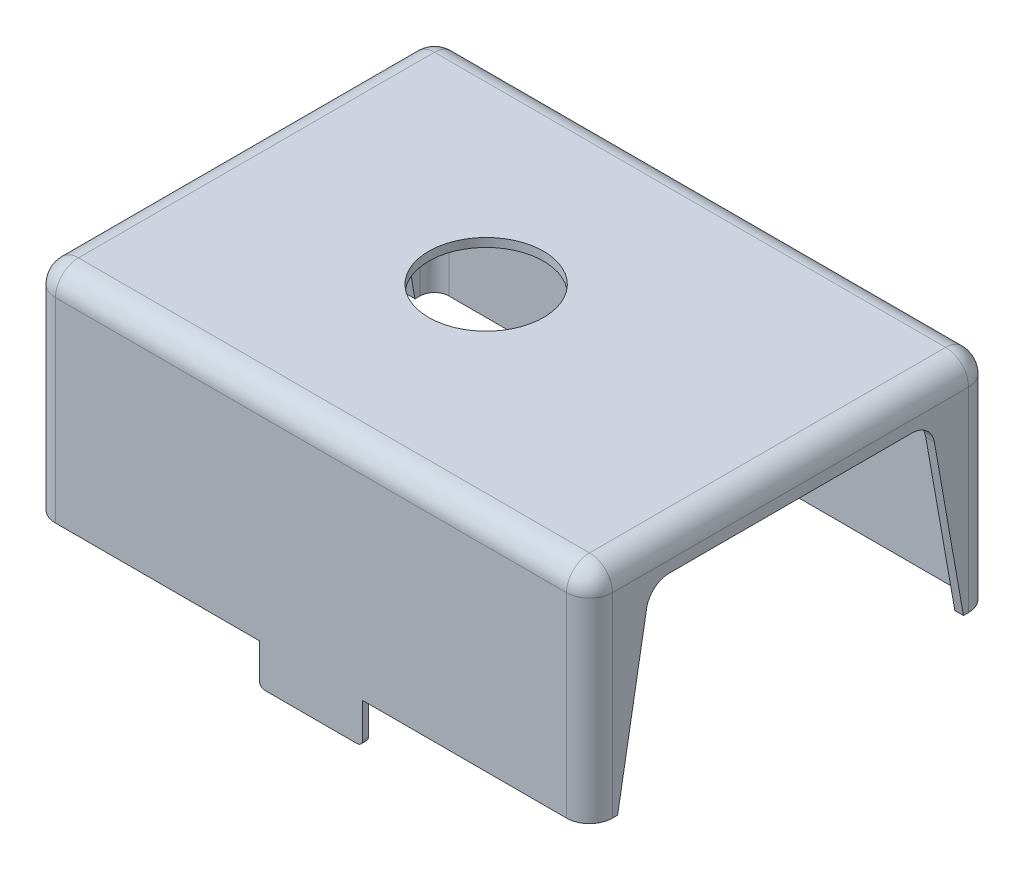
from build123d import *

# Parameters (mm, degrees)
RESSALTO_EXTRUS_O1_DEPTH           = 38
FILETE1_R                          = 4
CASCA1_T                           = -1.5
CORTE_EXTRUS_O1_DEPTH              = 50
ESBO_O3_R                          = 2
ESBO_O3_R_2                        = 1
RESSALTO_EXTRUS_O2_DEPTH           = 5
RESSALTO_EXTRUS_O2_DRAFT           = 2
RESSALTO_EXTRUS_O2_PROFILE_2_DEPTH = 5
RESSALTO_EXTRUS_O2_PROFILE_2_DRAFT = 2
RESSALTO_EXTRUS_O2_PROFILE_3_DEPTH = 5
RESSALTO_EXTRUS_O2_PROFILE_3_DRAFT = 2
RESSALTO_EXTRUS_O2_PROFILE_4_DEPTH = 5
RESSALTO_EXTRUS_O2_PROFILE_4_DRAFT = 2
RESSALTO_EXTRUS_O3_DEPTH           = 1
RESSALTO_EXTRUS_O4_DEPTH           = 5.5
ESBO_O6_R                          = 10
CORTE_EXTRUS_O2_DEPTH              = 75.848179671


with BuildPart() as part:
    # Esboço1 → Ressalto-extrusão1 (new body)
    with BuildSketch(Plane(origin=(0, 0, 0), x_dir=(1, 0, 0), z_dir=(0, 1, 0))):
        with BuildLine():
            Line((-44.5, 35), (44.5, 35))
            ThreePointArc((44.5, 35), (47.328427125, 33.828427125), (48.5, 31))
            Line((48.5, 31), (48.5, -31))
            ThreePointArc((48.5, -31), (47.328427125, -33.828427125), (44.5, -35))
            Line((44.5, -35), (-44.5, -35))
            ThreePointArc((-44.5, -35), (-47.328427125, -33.828427125), (-48.5, -31))
            Line((-48.5, -31), (-48.5, 31))
            ThreePointArc((-48.5, 31), (-47.328427125, 33.828427125), (-44.5, 35))
        make_face()
    extrude(amount=-RESSALTO_EXTRUS_O1_DEPTH)

    # Filete1
    filete1_edges = [part.edges().sort_by_distance(p)[0] for p in [
        (48.5, 0, 0),
        (47.328427125, 0, 33.828427125),
        (0, 0, 35),
        (-47.328427125, 0, 33.828427125),
        (-48.5, 0, 0),
        (-47.328427125, 0, -33.828427125),
        (0, 0, -35),
        (47.328427125, 0, -33.828427125),
    ]]
    fillet(filete1_edges, radius=FILETE1_R)

    # Casca1
    casca1_openings = [part.faces().sort_by_distance(p)[0] for p in [
        (0, -38, 0),
    ]]
    offset(amount=CASCA1_T, openings=casca1_openings, kind=Kind.INTERSECTION)

    # Esboço2 → Corte-extrusão1 (cut, symmetric)
    with BuildSketch(Plane(origin=(0, 0, 0), x_dir=(0, 0, -1), z_dir=(1, 0, 0))):
        with BuildLine():
            Line((-21.110742301, -6), (21.110742301, -6))
            ThreePointArc((21.110742301, -6), (23.68189274, -6.935822228), (25.049973313, -9.305407289))
            Line((25.049973313, -9.305407289), (31, -43.049685465))
            Line((31, -43.049685465), (-31, -43.049685465))
            Line((-31, -43.049685465), (-25.049973313, -9.305407289))
            ThreePointArc((-25.049973313, -9.305407289), (-23.68189274, -6.935822228), (-21.110742301, -6))
        make_face()
    extrude(amount=CORTE_EXTRUS_O1_DEPTH, both=True, mode=Mode.SUBTRACT)


with BuildPart() as ressalto_extrus_o2_tool:
    # Esboço3 → Ressalto-extrusão2 (with draft: the straight prism first)
    with BuildSketch(Plane.XZ.offset(1.5)):
        with Locations((-28, 15)):
            Circle(ESBO_O3_R)
        with Locations((-28, 15)):
            Circle(ESBO_O3_R_2, mode=Mode.SUBTRACT)
    extrude(amount=RESSALTO_EXTRUS_O2_DEPTH)
    # Ressalto-extrusão2: the draft: its side faces are tilted about the plane it starts from
    ressalto_extrus_o2_sides = [ressalto_extrus_o2_tool.faces().sort_by_distance(p)[0] for p in [
        (-30, -4, 15),
        (-29, -4, 15),
    ]]
    draft(ressalto_extrus_o2_sides, Plane.XZ.offset(1.5), RESSALTO_EXTRUS_O2_DRAFT)


with BuildPart() as part_1:
    add(part.part)

    # Ressalto-extrusão2: add ressalto_extrus_o2_tool
    add(ressalto_extrus_o2_tool.part)


with BuildPart() as ressalto_extrus_o2_profile_2_tool:
    # Esboço3 → Ressalto-extrusão2 profile 2 (with draft: the straight prism first)
    with BuildSketch(Plane.XZ.offset(1.5)):
        with Locations((28, 15)):
            Circle(ESBO_O3_R)
        with Locations((28, 15)):
            Circle(ESBO_O3_R_2, mode=Mode.SUBTRACT)
    extrude(amount=RESSALTO_EXTRUS_O2_PROFILE_2_DEPTH)
    # Ressalto-extrusão2 profile 2: the draft: its side faces are tilted about the plane it starts from
    ressalto_extrus_o2_profile_2_sides = [ressalto_extrus_o2_profile_2_tool.faces().sort_by_distance(p)[0] for p in [
        (26, -4, 15),
        (27, -4, 15),
    ]]
    draft(ressalto_extrus_o2_profile_2_sides, Plane.XZ.offset(1.5), RESSALTO_EXTRUS_O2_PROFILE_2_DRAFT)


with BuildPart() as part_2:
    add(part_1.part)

    # Ressalto-extrusão2 profile 2: add ressalto_extrus_o2_profile_2_tool
    add(ressalto_extrus_o2_profile_2_tool.part)


with BuildPart() as ressalto_extrus_o2_profile_3_tool:
    # Esboço3 → Ressalto-extrusão2 profile 3 (with draft: the straight prism first)
    with BuildSketch(Plane.XZ.offset(1.5)):
        with Locations((28, -15)):
            Circle(ESBO_O3_R)
        with Locations((28, -15)):
            Circle(ESBO_O3_R_2, mode=Mode.SUBTRACT)
    extrude(amount=RESSALTO_EXTRUS_O2_PROFILE_3_DEPTH)
    # Ressalto-extrusão2 profile 3: the draft: its side faces are tilted about the plane it starts from
    ressalto_extrus_o2_profile_3_sides = [ressalto_extrus_o2_profile_3_tool.faces().sort_by_distance(p)[0] for p in [
        (26, -4, -15),
        (27, -4, -15),
    ]]
    draft(ressalto_extrus_o2_profile_3_sides, Plane.XZ.offset(1.5), RESSALTO_EXTRUS_O2_PROFILE_3_DRAFT)


with BuildPart() as part_3:
    add(part_2.part)

    # Ressalto-extrusão2 profile 3: add ressalto_extrus_o2_profile_3_tool
    add(ressalto_extrus_o2_profile_3_tool.part)


with BuildPart() as ressalto_extrus_o2_profile_4_tool:
    # Esboço3 → Ressalto-extrusão2 profile 4 (with draft: the straight prism first)
    with BuildSketch(Plane.XZ.offset(1.5)):
        with Locations((-28, -15)):
            Circle(ESBO_O3_R)
        with Locations((-28, -15)):
            Circle(ESBO_O3_R_2, mode=Mode.SUBTRACT)
    extrude(amount=RESSALTO_EXTRUS_O2_PROFILE_4_DEPTH)
    # Ressalto-extrusão2 profile 4: the draft: its side faces are tilted about the plane it starts from
    ressalto_extrus_o2_profile_4_sides = [ressalto_extrus_o2_profile_4_tool.faces().sort_by_distance(p)[0] for p in [
        (-30, -4, -15),
        (-29, -4, -15),
    ]]
    draft(ressalto_extrus_o2_profile_4_sides, Plane.XZ.offset(1.5), RESSALTO_EXTRUS_O2_PROFILE_4_DRAFT)


with BuildPart() as part_4:
    add(part_3.part)

    # Ressalto-extrusão2 profile 4: add ressalto_extrus_o2_profile_4_tool
    add(ressalto_extrus_o2_profile_4_tool.part)

    # Esboço4 → Ressalto-extrusão3 (add)
    with BuildSketch(Plane.XY.offset(35)):
        with BuildLine():
            Line((-9, -38), (9, -38))
            Line((9, -38), (9, -44))
            ThreePointArc((9, -44), (8.707106781, -44.707106781), (8, -45))
            Line((8, -45), (-8, -45))
            ThreePointArc((-8, -45), (-8.707106781, -44.707106781), (-9, -44))
            Line((-9, -44), (-9, -38))
        make_face()
    ressalto_extrus_o3 = extrude(amount=-RESSALTO_EXTRUS_O3_DEPTH)

    # Esboço5 → Ressalto-extrusão4 (add, symmetric)
    with BuildSketch(Plane(origin=(0, 0, 0), x_dir=(0, 0, -1), z_dir=(1, 0, 0))):
        Polygon((-34, -40), (-32.5, -40), (-32.5, -40.5), (-34, -42), align=None)
    ressalto_extrus_o4 = extrude(amount=RESSALTO_EXTRUS_O4_DEPTH, both=True)

    # Espelhar1: Ressalto-extrusão3, Ressalto-extrusão4 across plane
    add(ressalto_extrus_o3.mirror(Plane.XY))
    add(ressalto_extrus_o4.mirror(Plane.XY))

    # Esboço6 → Corte-extrusão2 (cut, through all)
    with BuildSketch(Plane(origin=(0, 0, 0), x_dir=(1, 0, 0), z_dir=(0, 1, 0))):
        with Locations(Location((-5, 0.5, 0), (0, 0, 270))):
            Circle(ESBO_O6_R)
    extrude(amount=-CORTE_EXTRUS_O2_DEPTH, mode=Mode.SUBTRACT)


solid = part_4.part
